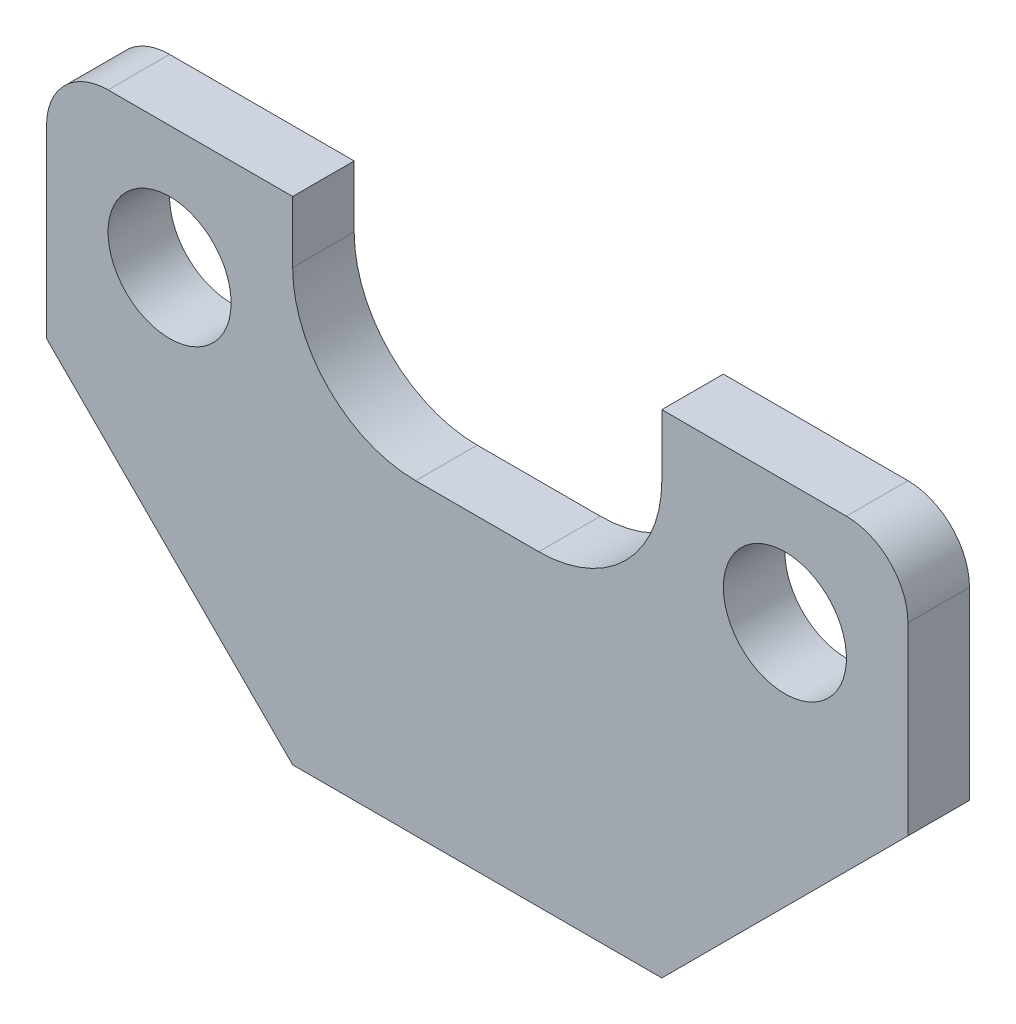
from build123d import *

# Parameters (mm, degrees)
SKETCH1_R           = 5
BOSS_EXTRUDE1_DEPTH = 5


with BuildPart() as part:
    # Sketch1 → Boss-Extrude1 (new body)
    with BuildSketch(Plane.XY):
        with BuildLine():
            Line((15, 0), (-15, 0))
            Line((-15, 0), (-35, 20))
            Line((-35, 20), (-35, 35))
            ThreePointArc((-35, 35), (-33.535533906, 38.535533906), (-30, 40))
            Line((-30, 40), (-15, 40))
            Line((-15, 40), (-15, 35))
            ThreePointArc((-15, 35), (-12.071067812, 27.928932188), (-5, 25))
            Line((-5, 25), (5, 25))
            ThreePointArc((5, 25), (12.071067812, 27.928932188), (15, 35))
            Line((15, 35), (15, 40))
            Line((15, 40), (30, 40))
            ThreePointArc((30, 40), (33.535533906, 38.535533906), (35, 35))
            Line((35, 35), (35, 20))
            Line((35, 20), (15, 0))
        make_face()
        with Locations((-25, 30)):
            Circle(SKETCH1_R, mode=Mode.SUBTRACT)
        with Locations(Location((25, 30, 0), (0, 0, 180))):
            Circle(SKETCH1_R, mode=Mode.SUBTRACT)
    extrude(amount=BOSS_EXTRUDE1_DEPTH)


solid = part.part
